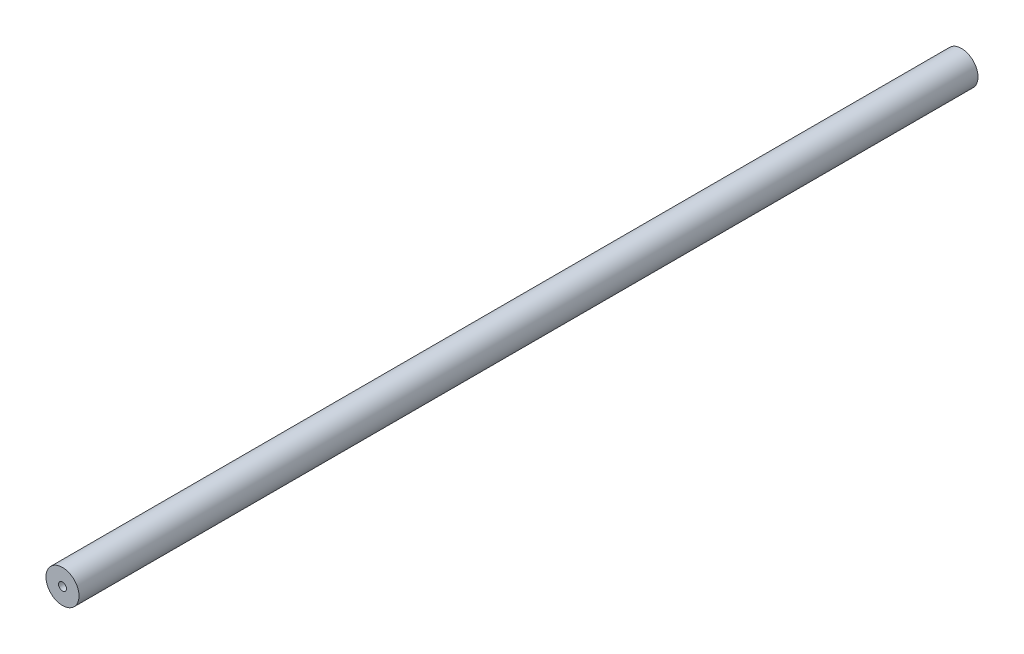
from build123d import *

# Parameters (mm, degrees)
IZIM1_R                     = 12.5
IZIM1_R_2                   = 3
Y_KSEKLIK_EKSTR_ZYON1_DEPTH = 680


with BuildPart() as part:
    # Çizim1 → Yükseklik-Ekstrüzyon1 (new body)
    with BuildSketch(Plane.XY):
        Circle(IZIM1_R)
        Circle(IZIM1_R_2, mode=Mode.SUBTRACT)
    extrude(amount=Y_KSEKLIK_EKSTR_ZYON1_DEPTH)


solid = part.part
